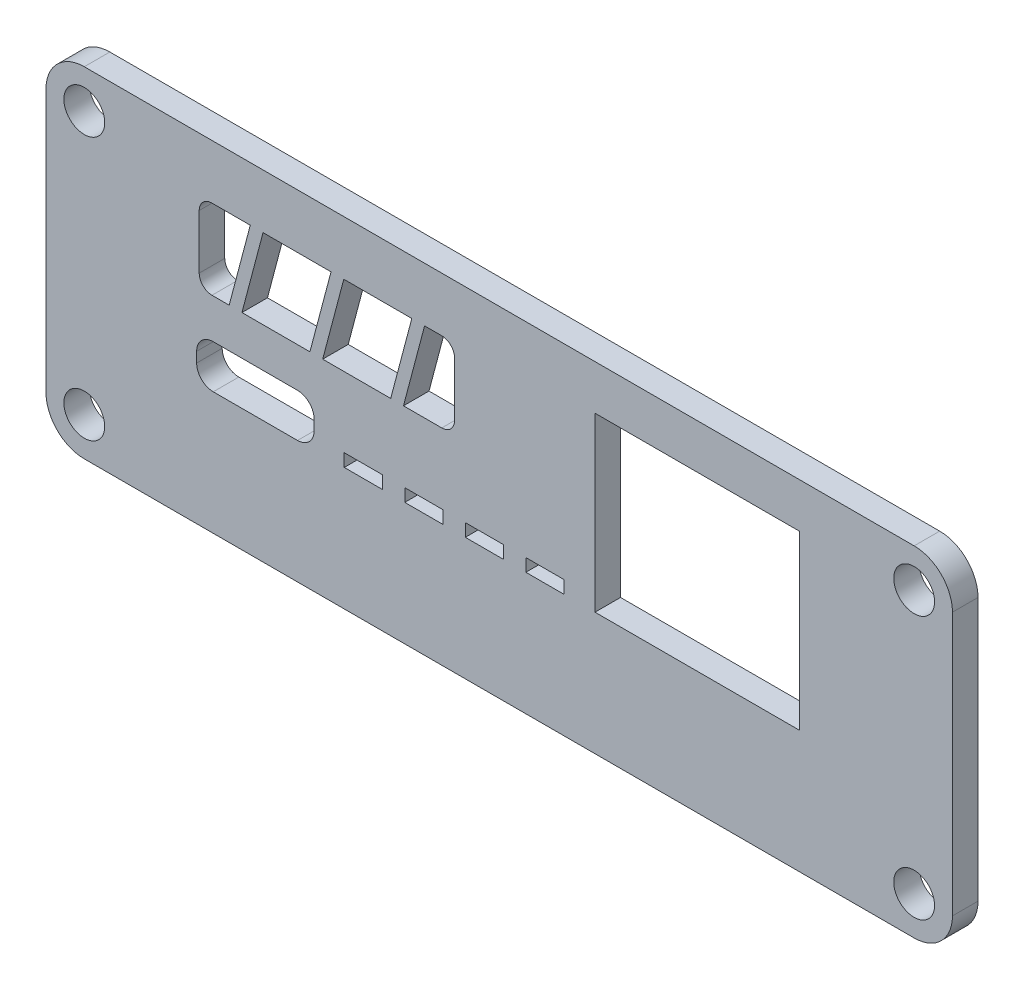
from build123d import *

# Parameters (mm, degrees)
SKETCH_1_R          = 1.6
EXTRUDE_1_DEPTH     = 2
SKETCH_2_W          = 16
SKETCH_2_H          = 13.5
SKETCH_2_W_2        = 3
SKETCH_2_H_2        = 1
CUT_EXTRUDE_2_DEPTH = 2
SKETCH_3_W          = 20
SKETCH_3_H          = 2.5
EXTRUDE_2_DEPTH     = 20
CUT_EXTRUDE_3_DEPTH = 20
SKETCH_6_W          = 20
SKETCH_6_H          = 2.5
CUT_EXTRUDE_4_DEPTH = 20


with BuildPart() as part:
    # 草图1 → 凸台-拉伸1 (new body)
    with BuildSketch(Plane.XY):
        with BuildLine():
            Line((3, 0), (68, 0))
            ThreePointArc((68, 0), (70.121320344, -0.878679656), (71, -3))
            Line((71, -3), (71, -23.6))
            ThreePointArc((71, -23.6), (70.121320344, -25.721320344), (68, -26.6))
            Line((68, -26.6), (3, -26.6))
            ThreePointArc((3, -26.6), (0.878679656, -25.721320344), (0, -23.6))
            Line((0, -23.6), (0, -3))
            ThreePointArc((0, -3), (0.878679656, -0.878679656), (3, 0))
        make_face()
        with Locations((3, -3)):
            Circle(SKETCH_1_R, mode=Mode.SUBTRACT)
        with Locations((68, -3)):
            Circle(SKETCH_1_R, mode=Mode.SUBTRACT)
        with Locations((68, -23.6)):
            Circle(SKETCH_1_R, mode=Mode.SUBTRACT)
        with Locations((3, -23.6)):
            Circle(SKETCH_1_R, mode=Mode.SUBTRACT)
    extrude(amount=EXTRUDE_1_DEPTH)

    # 草图2 → 切除-拉伸2 (cut)
    with BuildSketch(Plane(origin=(0, 0, 0), x_dir=(-1, 0, 0), z_dir=(0, 0, -1))):
        with Locations((-51, -10.25)):
            Rectangle(SKETCH_2_W, SKETCH_2_H)
        with BuildLine():
            Line((-19.7, -17), (-13.1, -17))
            ThreePointArc((-13.1, -17), (-12.180761184, -16.619238816), (-11.8, -15.7))
            Line((-11.8, -15.7), (-11.8, -14.9))
            ThreePointArc((-11.8, -14.9), (-12.180761184, -13.980761184), (-13.1, -13.6))
            Line((-13.1, -13.6), (-19.7, -13.6))
            ThreePointArc((-19.7, -13.6), (-20.619238816, -13.980761184), (-21, -14.9))
            Line((-21, -14.9), (-21, -15.7))
            ThreePointArc((-21, -15.7), (-20.619238816, -16.619238816), (-19.7, -17))
        make_face()
        with Locations((-39.084, -16.5)):
            Rectangle(SKETCH_2_W_2, SKETCH_2_H_2)
        with Locations((-34.343, -16.5)):
            Rectangle(SKETCH_2_W_2, SKETCH_2_H_2)
        with Locations((-29.601, -16.5)):
            Rectangle(SKETCH_2_W_2, SKETCH_2_H_2)
        with Locations((-24.86, -16.5)):
            Rectangle(SKETCH_2_W_2, SKETCH_2_H_2)
    extrude(amount=-CUT_EXTRUDE_2_DEPTH, mode=Mode.SUBTRACT)

    # 草图3 → 凸台-拉伸2 (add)
    with BuildSketch(Plane.XY.offset(2)):
        with Locations((22, -3)):
            Rectangle(SKETCH_3_W, SKETCH_3_H)
    extrude(amount=EXTRUDE_2_DEPTH)

    # 草图5 → 切除-拉伸3 (cut)
    with BuildSketch(Plane.XY.offset(2)):
        with BuildLine():
            Line((14.347228721, -10.5), (16, -4.25))
            Line((16, -4.25), (13, -4.25))
            ThreePointArc((13, -4.25), (12.292893219, -4.542893219), (12, -5.25))
            Line((12, -5.25), (12, -9.5))
            ThreePointArc((12, -9.5), (12.292893219, -10.207106781), (13, -10.5))
            Line((13, -10.5), (14.347228721, -10.5))
        make_face()
        Polygon((22.325, -4.25), (17, -4.25), (15.347228721, -10.5), (20.672228721, -10.5), align=None)
        Polygon((28.652771279, -4.25), (23.325, -4.25), (21.672228721, -10.5), (27, -10.5), align=None)
        with BuildLine():
            Line((31, -4.25), (29.652771279, -4.25))
            Line((29.652771279, -4.25), (28, -10.5))
            Line((28, -10.5), (31, -10.5))
            ThreePointArc((31, -10.5), (31.707106781, -10.207106781), (32, -9.5))
            Line((32, -9.5), (32, -5.25))
            ThreePointArc((32, -5.25), (31.707106781, -4.542893219), (31, -4.25))
        make_face()
    extrude(amount=-CUT_EXTRUDE_3_DEPTH, mode=Mode.SUBTRACT)

    # 草图6 → 切除-拉伸4 (cut)
    with BuildSketch(Plane.XY.offset(22)):
        with Locations((22, -3)):
            Rectangle(SKETCH_6_W, SKETCH_6_H)
    extrude(amount=-CUT_EXTRUDE_4_DEPTH, mode=Mode.SUBTRACT)


solid = part.part
